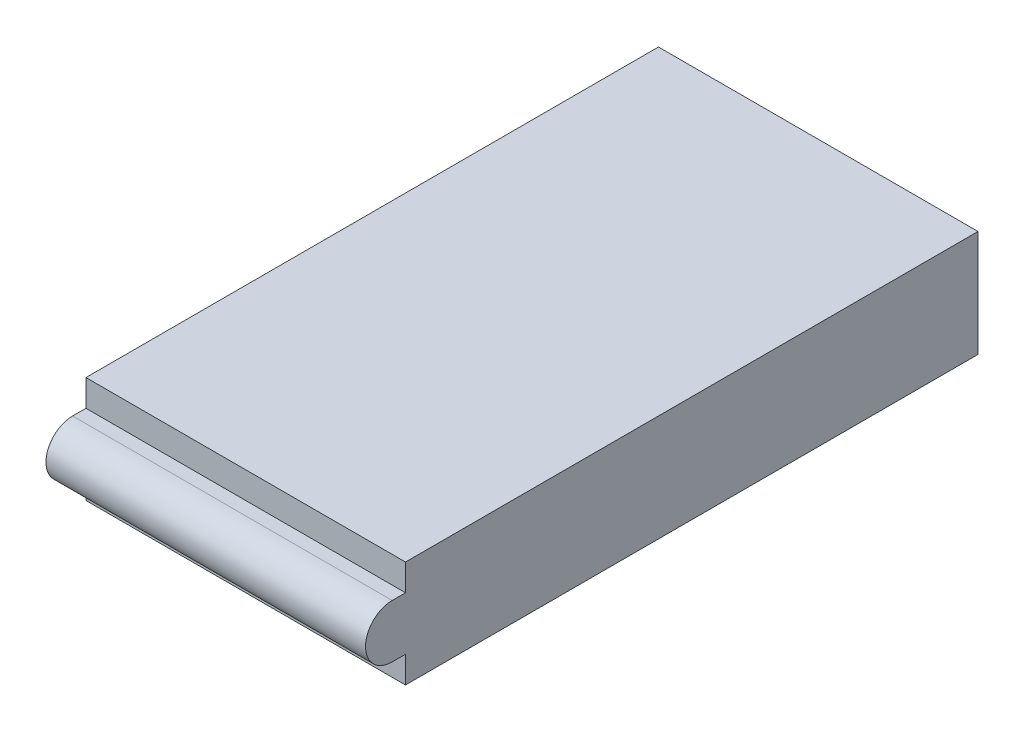
from build123d import *

# Parameters (mm, degrees)
SKETCH_1_W      = 24
SKETCH_1_H      = 43
EXTRUDE_1_DEPTH = 8
EXTRUDE_2_DEPTH = 24


with BuildPart() as part:
    # 草图1 → 凸台-拉伸1 (new body)
    with BuildSketch(Plane(origin=(0, 0, 0), x_dir=(1, 0, 0), z_dir=(0, 1, 0))):
        with Locations((12, 21.5)):
            Rectangle(SKETCH_1_W, SKETCH_1_H)
    extrude(amount=EXTRUDE_1_DEPTH)

    # 草图2 → 凸台-拉伸2 (add)
    with BuildSketch(Plane(origin=(24, 0, 0), x_dir=(0, 0, -1), z_dir=(1, 0, 0))):
        with BuildLine():
            Line((0, 2), (-1, 2))
            ThreePointArc((-1, 2), (-3, 4), (-1, 6))
            Line((-1, 6), (0, 6))
            ThreePointArc((0, 6), (2, 4), (0, 2))
        make_face()
    extrude(amount=-EXTRUDE_2_DEPTH)


solid = part.part
